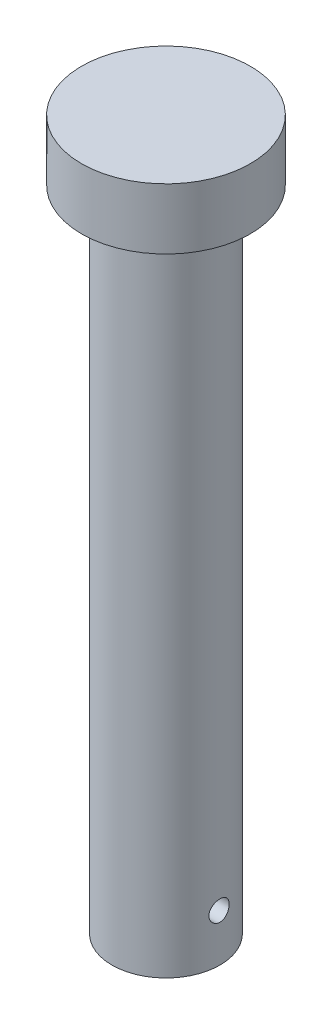
from build123d import *

# Parameters (mm, degrees)
SKETCH1_R           = 12.5
SKETCH1_R_2         = 8
BOSS_EXTRUDE1_DEPTH = 9
BOSS_EXTRUDE2_START = -9
SKETCH1_3_R         = 8
BOSS_EXTRUDE2_DEPTH = 96
SKETCH2_R           = 1.5
CUT_EXTRUDE1_DEPTH  = 18


with BuildPart() as part:
    # Sketch1 → Boss-Extrude1 (new body)
    # profile 1 of 2: a face of its own
    with BuildSketch(Plane(origin=(0, 0, 0), x_dir=(1, 0, 0), z_dir=(0, 1, 0))):
        with Locations(Location((0, 0, 0), (0, 0, 270))):
            Circle(SKETCH1_R)
        Circle(SKETCH1_R_2, mode=Mode.SUBTRACT)
    # profile 2 of 2: a face of its own
    with BuildSketch(Plane(origin=(0, 0, 0), x_dir=(1, 0, 0), z_dir=(0, 1, 0))):
        Circle(SKETCH1_R_2)
    extrude(amount=-BOSS_EXTRUDE1_DEPTH)

    # Sketch1<3> → Boss-Extrude2 (add)
    with BuildSketch(Plane(origin=(0, 0, 0), x_dir=(1, 0, 0), z_dir=(0, 1, 0)).offset(BOSS_EXTRUDE2_START)):
        with Locations(Location((0, 0, 0), (0, 0, 270))):
            Circle(SKETCH1_3_R)
    extrude(amount=-BOSS_EXTRUDE2_DEPTH)

    # Sketch2 → Cut-Extrude1 (cut, symmetric)
    with BuildSketch(Plane(origin=(0, 0, 0), x_dir=(0, 0, -1), z_dir=(1, 0, 0))):
        with Locations((0, -98)):
            Circle(SKETCH2_R)
    extrude(amount=CUT_EXTRUDE1_DEPTH, both=True, mode=Mode.SUBTRACT)


solid = part.part
